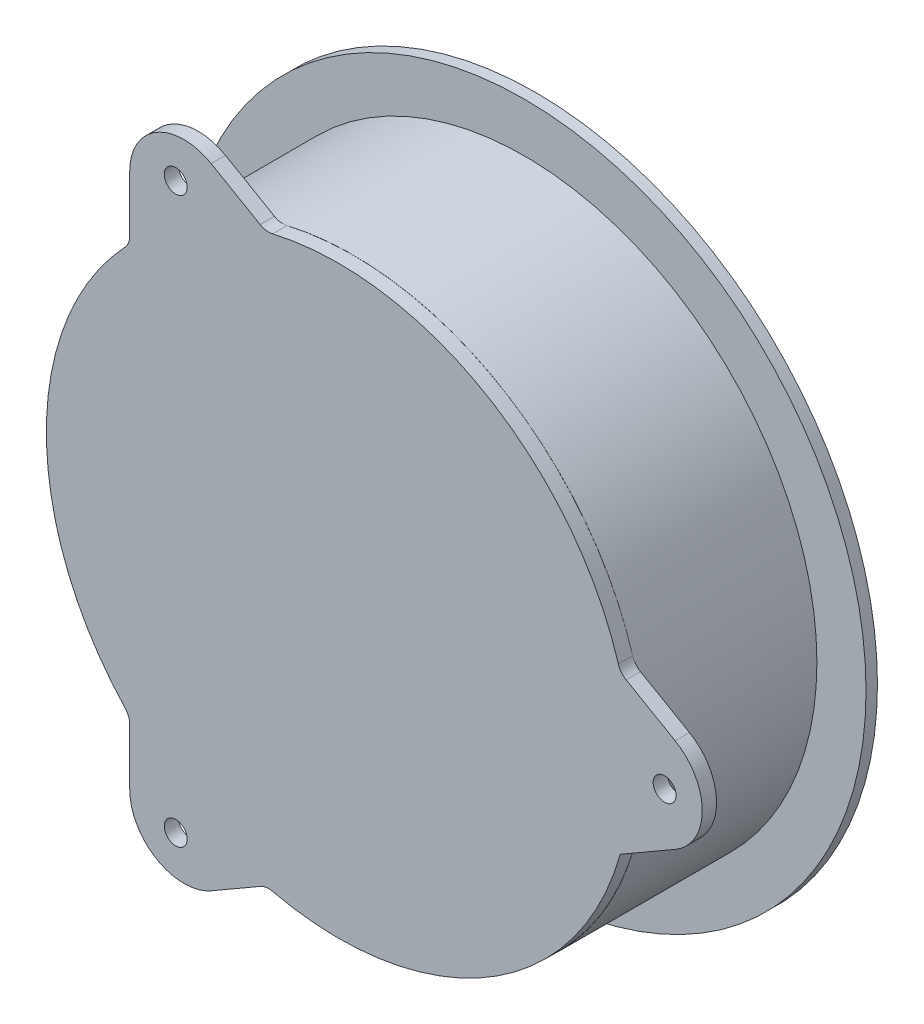
from build123d import *

# Parameters (mm, degrees)
SKETCH4_R      = 151.840016695
SKETCH4_R_2    = 128.375867971
EXTRUDE1_DEPTH = 5.08
SKETCH6_R      = 129.999844579
SKETCH6_R_2    = 124.85482448
EXTRUDE2_DEPTH = 76.2
SKETCH8_R      = 5.099609744
EXTRUDE3_DEPTH = 6.35


with BuildPart() as part:
    # Sketch4 → Extrude1 (new body)
    with BuildSketch(Plane.XY):
        Circle(SKETCH4_R)
        Circle(SKETCH4_R_2, mode=Mode.SUBTRACT)
    extrude(amount=EXTRUDE1_DEPTH)

    # Sketch6 → Extrude2 (add)
    with BuildSketch(Plane.XY.offset(5.08)):
        with Locations(Location((0, 0, 0), (0, 0, 180))):
            Circle(SKETCH6_R)
        with Locations(Location((0, 0, 0), (0, 0, 180))):
            Circle(SKETCH6_R_2, mode=Mode.SUBTRACT)
    extrude(amount=EXTRUDE2_DEPTH)

    # Sketch8 → Extrude3 (add)
    with BuildSketch(Plane.XY.offset(81.28)):
        with BuildLine():
            Line((-92.869363805, -93.93198337), (-92.869363805, -119.06007059))
            ThreePointArc((-92.869363805, -119.06007059), (-80.804363805, -139.957263584), (-56.674363805, -139.957263584))
            Line((-56.674363805, -139.957263584), (-34.912801923, -127.393219973))
            ThreePointArc((-34.912801923, -127.393219973), (-32.224618976, -126.455362905), (-29.379828181, -126.569681633))
            ThreePointArc((-29.379828181, -126.569681633), (66.249521237, -111.776829211), (125.135094286, -34.989524014))
            Line((125.135094286, -34.989524014), (149.54372761, -20.897192993))
            ThreePointArc((149.54372761, -20.897192993), (161.60872761, 0), (149.54372761, 20.897192993))
            Line((149.54372761, 20.897192993), (127.782165728, 33.461236604))
            ThreePointArc((127.782165728, 33.461236604), (125.625866209, 35.320342792), (124.302473734, 37.841163253))
            ThreePointArc((124.302473734, 37.841163253), (64.96741224, 112.526858836), (-29.379828181, 126.569681633))
            ThreePointArc((-29.379828181, 126.569681633), (-32.224618976, 126.455362905), (-34.912801923, 127.393219973))
            Line((-34.912801923, 127.393219973), (-56.674363805, 139.957263584))
            ThreePointArc((-56.674363805, 139.957263584), (-80.804363805, 139.957263584), (-92.869363805, 119.06007059))
            Line((-92.869363805, 119.06007059), (-92.869363805, 93.93198337))
            ThreePointArc((-92.869363805, 93.93198337), (-93.401247233, 91.135020113), (-94.922645552, 88.72851838))
            ThreePointArc((-94.922645552, 88.72851838), (-129.93482448, 0), (-94.922645552, -88.72851838))
            ThreePointArc((-94.922645552, -88.72851838), (-93.401247233, -91.135020113), (-92.869363805, -93.93198337))
        make_face()
        with Locations((-72.432875103, 125.457419816)):
            Circle(SKETCH8_R, mode=Mode.SUBTRACT)
        with Locations((144.865750205, 0)):
            Circle(SKETCH8_R, mode=Mode.SUBTRACT)
        with Locations((-72.432875103, -125.457419816)):
            Circle(SKETCH8_R, mode=Mode.SUBTRACT)
    extrude(amount=EXTRUDE3_DEPTH)


solid = part.part
